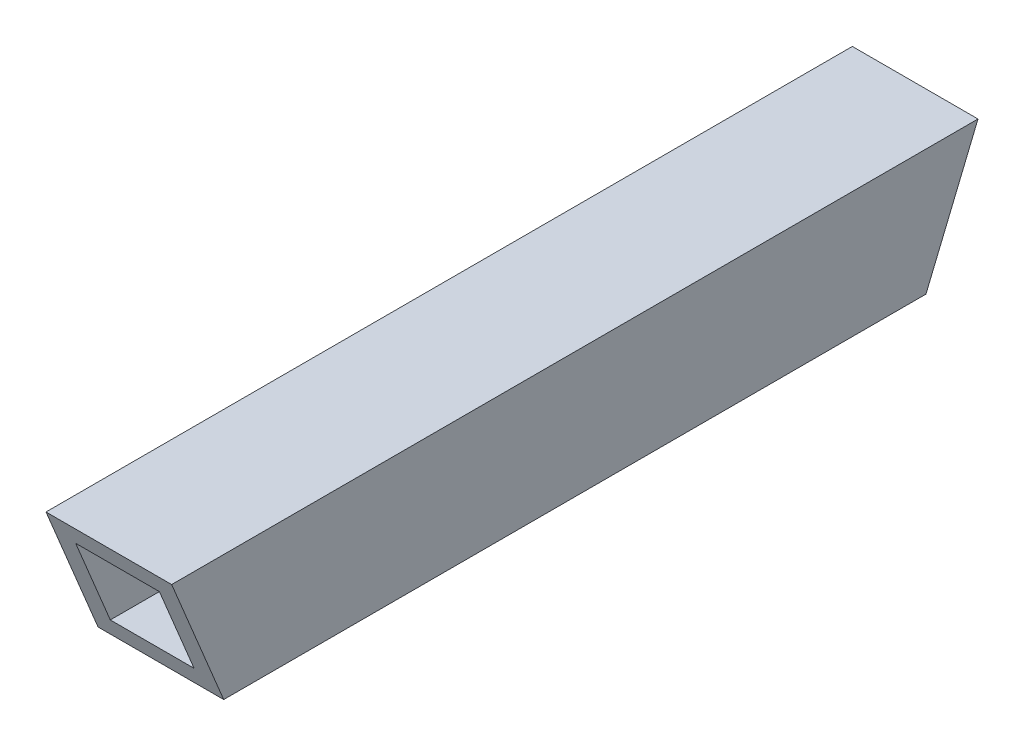
from build123d import *

# Parameters (mm, degrees)
SKETCH1_W           = 19.05
SKETCH1_H           = 19.05
SKETCH1_W_2         = 12.7
SKETCH1_H_2         = 12.7
BOSS_EXTRUDE1_DEPTH = 61.11875
CUT_EXTRUDE1_DEPTH  = 65.723486669


with BuildPart() as part:
    # Sketch1 → Boss-Extrude1 (new, symmetric)
    with BuildSketch(Plane.XY):
        Rectangle(SKETCH1_W, SKETCH1_H)
        Rectangle(SKETCH1_W_2, SKETCH1_H_2, mode=Mode.SUBTRACT)
    extrude(amount=BOSS_EXTRUDE1_DEPTH, both=True)

    # Sketch2 → Cut-Extrude1 (cut, through all)
    with BuildSketch(Plane(origin=(9.525, 0, 0), x_dir=(0, 0, -1), z_dir=(1, 0, 0))):
        Polygon((-61.11875, 9.525), (-53.227981637, -9.525), (-61.11875, -9.525), align=None)
        Polygon((61.11875, 9.525), (53.227981637, -9.525), (61.11875, -9.525), align=None)
    extrude(amount=-CUT_EXTRUDE1_DEPTH, mode=Mode.SUBTRACT)


solid = part.part
